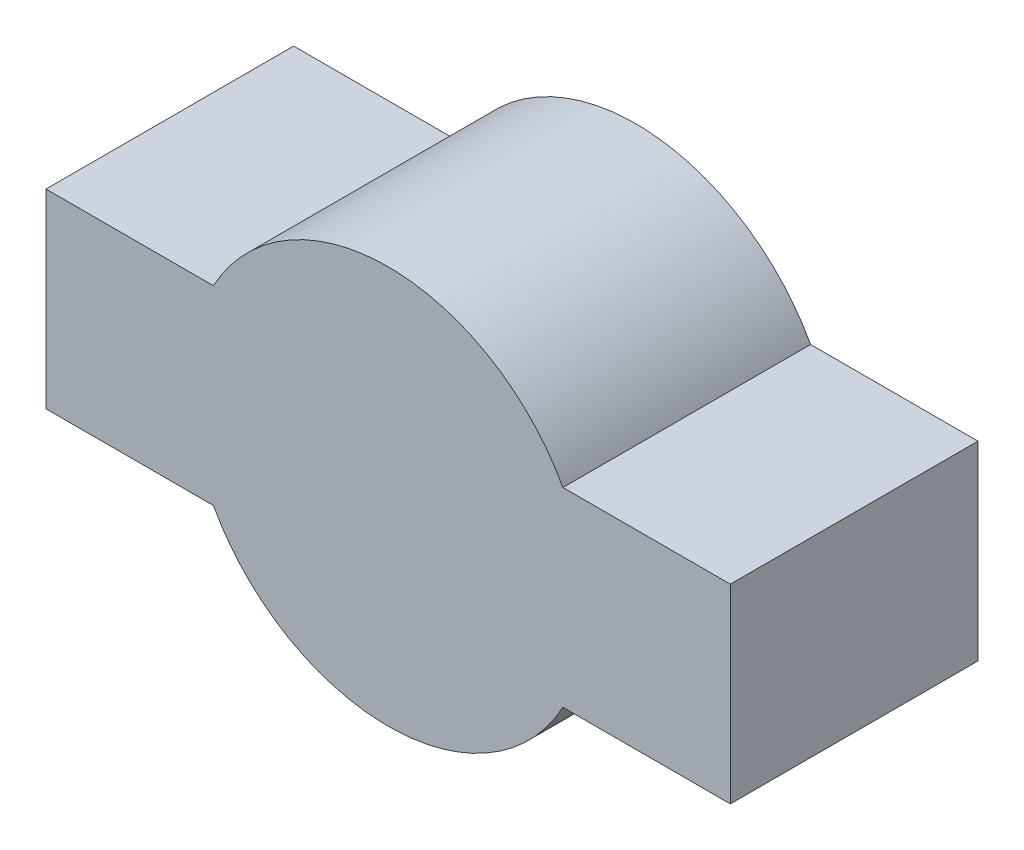
from build123d import *

# Parameters (mm, degrees)
SKETCH_1_R      = 80.348196739
SKETCH_1_W      = 276.308595414
SKETCH_1_H      = 76.854046406
EXTRUDE_1_DEPTH = 100


with BuildPart() as part:
    # 草图1 → 凸台-拉伸1 (new body)
    with BuildSketch(Plane.XY):
        Circle(SKETCH_1_R)
        Rectangle(SKETCH_1_W, SKETCH_1_H)
    extrude(amount=EXTRUDE_1_DEPTH)


solid = part.part
